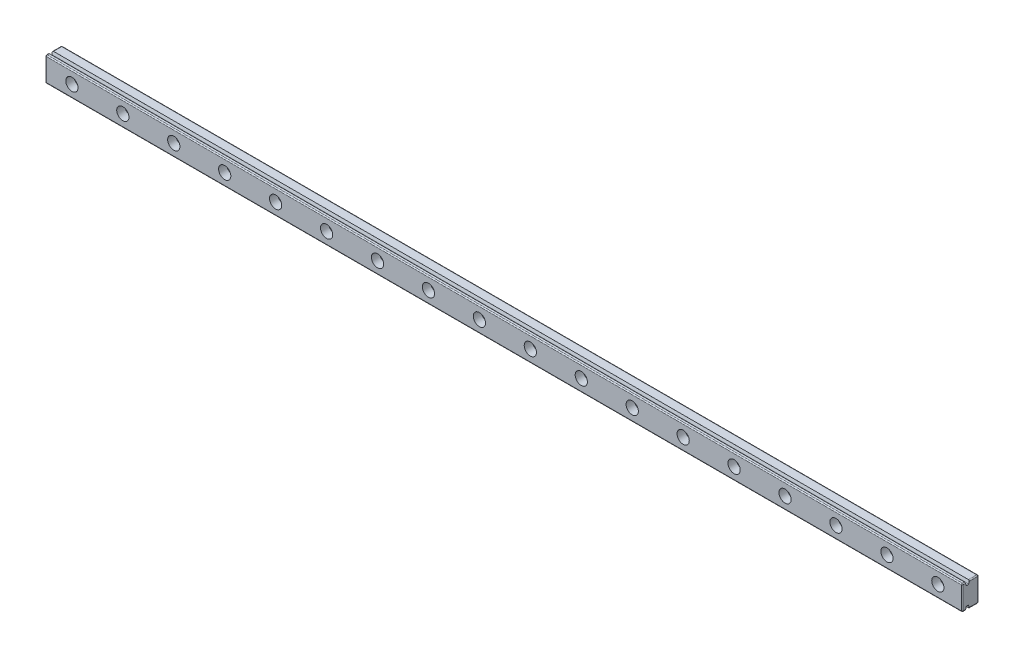
from build123d import *
from OCP.BRepFilletAPI import BRepFilletAPI_MakeChamfer

# Parameters (mm, degrees)
BOSS_EXTRUDE1_DEPTH = 450
SKETCH2_R           = 1.75
CUT_EXTRUDE1_DEPTH  = 10
SKETCH3_R           = 3
CUT_EXTRUDE2_DEPTH  = 4
CHAMFER1_SIZE       = 0.5
CHAMFER1_SIZE2      = 1.743707222
FILLET1_R           = 0.5


with BuildPart() as part:
    # Sketch1 → Boss-Extrude1 (new body)
    with BuildSketch(Plane(origin=(0, 0, 0), x_dir=(0, 0, -1), z_dir=(1, 0, 0))):
        Polygon((-0.5, 6), (4, 6), (4, -6), (-0.5, -6), (-0.5, -4.25), (-2.5, -4.25), (-2.5, -6), (-4, -6), (-4, 6), (-2.5, 6), (-2.5, 4.25), (-0.5, 4.25), align=None)
    extrude(amount=BOSS_EXTRUDE1_DEPTH)

    # Sketch2 → Cut-Extrude1 (cut)
    with BuildSketch(Plane.XY.offset(4)):
        with Locations((13, 0)):
            Circle(SKETCH2_R)
        with Locations((38, 0)):
            Circle(SKETCH2_R)
        with Locations((63, 0)):
            Circle(SKETCH2_R)
        with Locations((88, 0)):
            Circle(SKETCH2_R)
        with Locations((113, 0)):
            Circle(SKETCH2_R)
        with Locations((138, 0)):
            Circle(SKETCH2_R)
        with Locations((163, 0)):
            Circle(SKETCH2_R)
        with Locations((188, 0)):
            Circle(SKETCH2_R)
        with Locations((213, 0)):
            Circle(SKETCH2_R)
        with Locations((238, 0)):
            Circle(SKETCH2_R)
        with Locations((263, 0)):
            Circle(SKETCH2_R)
        with Locations((288, 0)):
            Circle(SKETCH2_R)
        with Locations((313, 0)):
            Circle(SKETCH2_R)
        with Locations((338, 0)):
            Circle(SKETCH2_R)
        with Locations((363, 0)):
            Circle(SKETCH2_R)
        with Locations((388, 0)):
            Circle(SKETCH2_R)
        with Locations((413, 0)):
            Circle(SKETCH2_R)
        with Locations((438, 0)):
            Circle(SKETCH2_R)
    extrude(amount=-CUT_EXTRUDE1_DEPTH, mode=Mode.SUBTRACT)

    # Sketch3 → Cut-Extrude2 (cut)
    with BuildSketch(Plane.XY.offset(4)):
        with Locations((13, 0)):
            Circle(SKETCH3_R)
        with Locations((38, 0)):
            Circle(SKETCH3_R)
        with Locations((63, 0)):
            Circle(SKETCH3_R)
        with Locations((88, 0)):
            Circle(SKETCH3_R)
        with Locations((113, 0)):
            Circle(SKETCH3_R)
        with Locations((138, 0)):
            Circle(SKETCH3_R)
        with Locations((163, 0)):
            Circle(SKETCH3_R)
        with Locations((188, 0)):
            Circle(SKETCH3_R)
        with Locations((213, 0)):
            Circle(SKETCH3_R)
        with Locations((238, 0)):
            Circle(SKETCH3_R)
        with Locations((263, 0)):
            Circle(SKETCH3_R)
        with Locations((288, 0)):
            Circle(SKETCH3_R)
        with Locations((313, 0)):
            Circle(SKETCH3_R)
        with Locations((338, 0)):
            Circle(SKETCH3_R)
        with Locations((363, 0)):
            Circle(SKETCH3_R)
        with Locations((388, 0)):
            Circle(SKETCH3_R)
        with Locations((413, 0)):
            Circle(SKETCH3_R)
        with Locations((438, 0)):
            Circle(SKETCH3_R)
    extrude(amount=-CUT_EXTRUDE2_DEPTH, mode=Mode.SUBTRACT)

    # Chamfer1: one chamfer whose edges measure the first distance from different faces: ONE call of the kernel's chamfer builder (chamfer() names one face for all edges)
    chamfer1_edges_1 = [part.edges().sort_by_distance(p)[0] for p in [
        (225, -4.25, 0.5),
        (225, -4.25, 2.5),
    ]]
    chamfer1_side_1 = [part.faces().sort_by_distance(p)[0] for p in [
        (225, -4.25, 1.5),
    ]]
    chamfer1_edges_2 = [part.edges().sort_by_distance(p)[0] for p in [
        (225, 4.25, 2.5),
        (225, 4.25, 0.5),
    ]]
    chamfer1_side_2 = [part.faces().sort_by_distance(p)[0] for p in [
        (225, 4.25, 1.5),
    ]]
    chamfer1 = BRepFilletAPI_MakeChamfer(part.part.solid().wrapped)
    for e in chamfer1_edges_1:
        chamfer1.Add(CHAMFER1_SIZE, CHAMFER1_SIZE2, e.wrapped, chamfer1_side_1[0].wrapped)  # the first distance lies on this face
    for e in chamfer1_edges_2:
        chamfer1.Add(CHAMFER1_SIZE, CHAMFER1_SIZE2, e.wrapped, chamfer1_side_2[0].wrapped)  # the first distance lies on this face
    add(Compound.cast(chamfer1.Shape()), mode=Mode.REPLACE)

    # Fillet1
    fillet1_edges = [part.edges().sort_by_distance(p)[0] for p in [
        (450, -6, -1.75),
        (450, 0, -4),
        (450, 6, -1.75),
        (450, 6, 3.25),
        (450, 0, 4),
        (450, -6, 3.25),
        (0, -6, 3.25),
        (0, -6, -1.75),
        (0, 0, -4),
        (0, 6, -1.75),
        (0, 6, 3.25),
        (0, 0, 4),
        (225, -4.25, 1),
        (225, -4.25, 2),
        (225, 4.25, 2),
        (225, 4.25, 1),
        (225, -6, 4),
        (225, 6, 4),
        (225, -6, -4),
        (225, 6, -4),
    ]]
    fillet(fillet1_edges, radius=FILLET1_R)


solid = part.part
